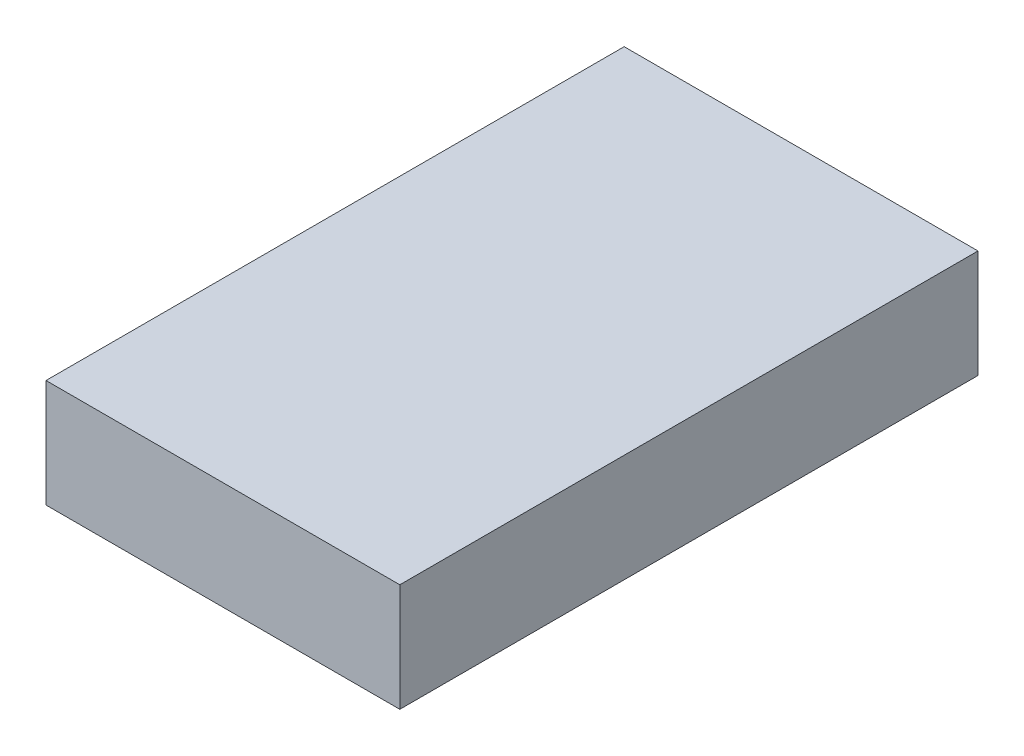
from build123d import *

# Parameters (mm, degrees)
SKETCH1_W           = 82
SKETCH1_H           = 134
BOSS_EXTRUDE1_DEPTH = 25


with BuildPart() as part:
    # Sketch1 → Boss-Extrude1 (new body)
    with BuildSketch(Plane(origin=(0, 0, 0), x_dir=(1, 0, 0), z_dir=(0, 1, 0))):
        Rectangle(SKETCH1_W, SKETCH1_H)
    extrude(amount=BOSS_EXTRUDE1_DEPTH)


solid = part.part
